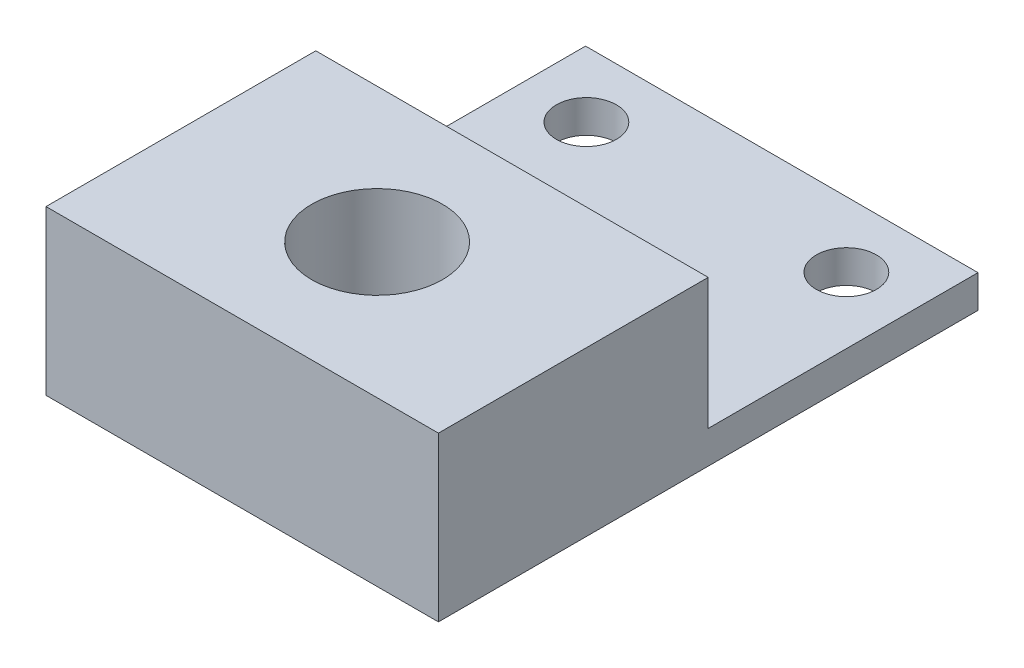
from build123d import *

# Parameters (mm, degrees)
SKETCH2_W           = 24
SKETCH2_H           = 16.5
SKETCH2_R           = 4
BOSS_EXTRUDE1_DEPTH = 10
SKETCH2_3_W         = 24
SKETCH2_3_H         = 16.5
SKETCH2_3_R         = 1.835
BOSS_EXTRUDE2_DEPTH = 2


with BuildPart() as part:
    # Sketch2 → Boss-Extrude1 (new body)
    with BuildSketch(Plane(origin=(0, 0, 0), x_dir=(1, 0, 0), z_dir=(0, 1, 0))):
        with Locations((0, -8.25)):
            Rectangle(SKETCH2_W, SKETCH2_H)
        with Locations((0, -8.25)):
            Circle(SKETCH2_R, mode=Mode.SUBTRACT)
    extrude(amount=BOSS_EXTRUDE1_DEPTH)

    # Sketch2<3> → Boss-Extrude2 (add)
    with BuildSketch(Plane(origin=(0, 0, 0), x_dir=(1, 0, 0), z_dir=(0, 1, 0))):
        with Locations((0, 8.25)):
            Rectangle(SKETCH2_3_W, SKETCH2_3_H)
        with Locations((-7.95, 12.5)):
            Circle(SKETCH2_3_R, mode=Mode.SUBTRACT)
        with Locations((7.95, 12.5)):
            Circle(SKETCH2_3_R, mode=Mode.SUBTRACT)
    extrude(amount=BOSS_EXTRUDE2_DEPTH)


solid = part.part
